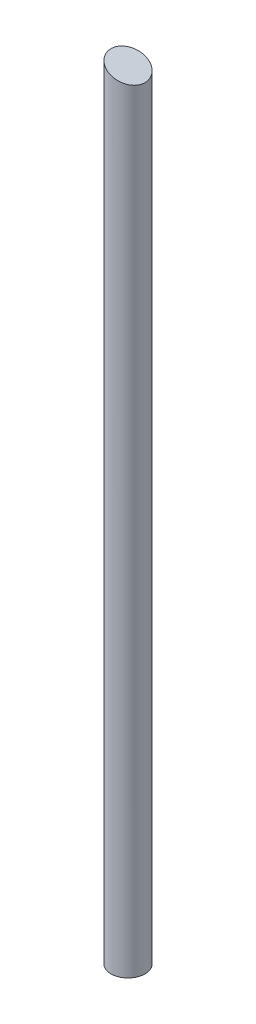
from build123d import *

# Parameters (mm, degrees)
SKETCH_1_R          = 3
EXTRUDE_1_DEPTH     = 138
CUT_EXTRUDE_2_DEPTH = 5


with BuildPart() as part:
    # 草圖1 → 填料-伸長1 (new body)
    with BuildSketch(Plane(origin=(0, 0, 0), x_dir=(1, 0, 0), z_dir=(0, 1, 0))):
        with Locations(Location((0, 0, 0), (0, 0, 270))):
            Circle(SKETCH_1_R)
    extrude(amount=EXTRUDE_1_DEPTH)

    # 草圖3 → 除料-伸長2 (cut, symmetric)
    with BuildSketch(Plane.XY):
        Polygon((-3, 138), (3, 135.816178594), (3, 138), align=None)
    extrude(amount=CUT_EXTRUDE_2_DEPTH, both=True, mode=Mode.SUBTRACT)


solid = part.part
